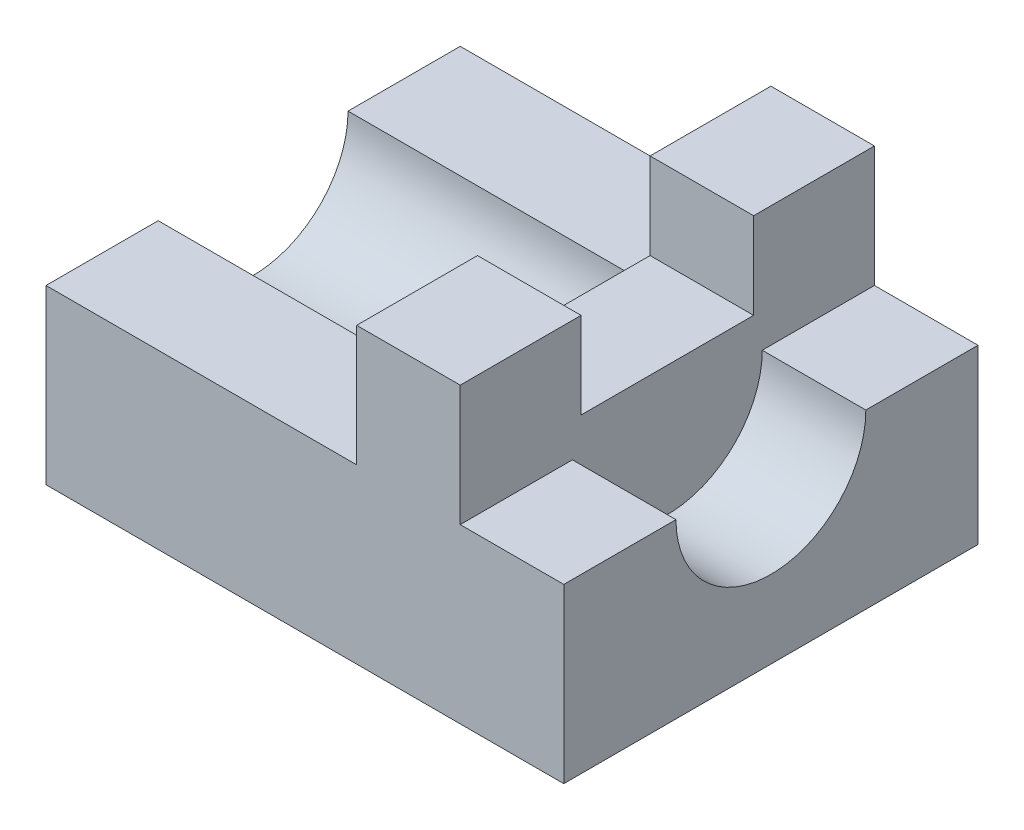
from build123d import *

# Parameters (mm, degrees)
EXTRUDE_1_DEPTH = 75
EXTRUDE_2_DEPTH = 30


with BuildPart() as part:
    # Эскиз1 → Бобышка-Вытянуть1 (new, symmetric)
    with BuildSketch(Plane(origin=(0, 0, 0), x_dir=(0, 0, -1), z_dir=(1, 0, 0))):
        with BuildLine():
            Line((-60, 25), (-60, -25))
            Line((-60, -25), (60, -25))
            Line((60, -25), (60, 25))
            Line((60, 25), (27.5, 25))
            ThreePointArc((27.5, 25), (0, -2.5), (-27.5, 25))
            Line((-27.5, 25), (-60, 25))
        make_face()
    extrude(amount=EXTRUDE_1_DEPTH, both=True)

    # Эскиз2 → Бобышка-Вытянуть2 (add)
    with BuildSketch(Plane(origin=(45, 0, 0), x_dir=(0, 0, -1), z_dir=(1, 0, 0))):
        Polygon((-60, -25), (60, -25), (60, 60), (25, 60), (25, 35), (-25, 35), (-25, 60), (-60, 60), align=None)
    extrude(amount=-EXTRUDE_2_DEPTH)


solid = part.part
